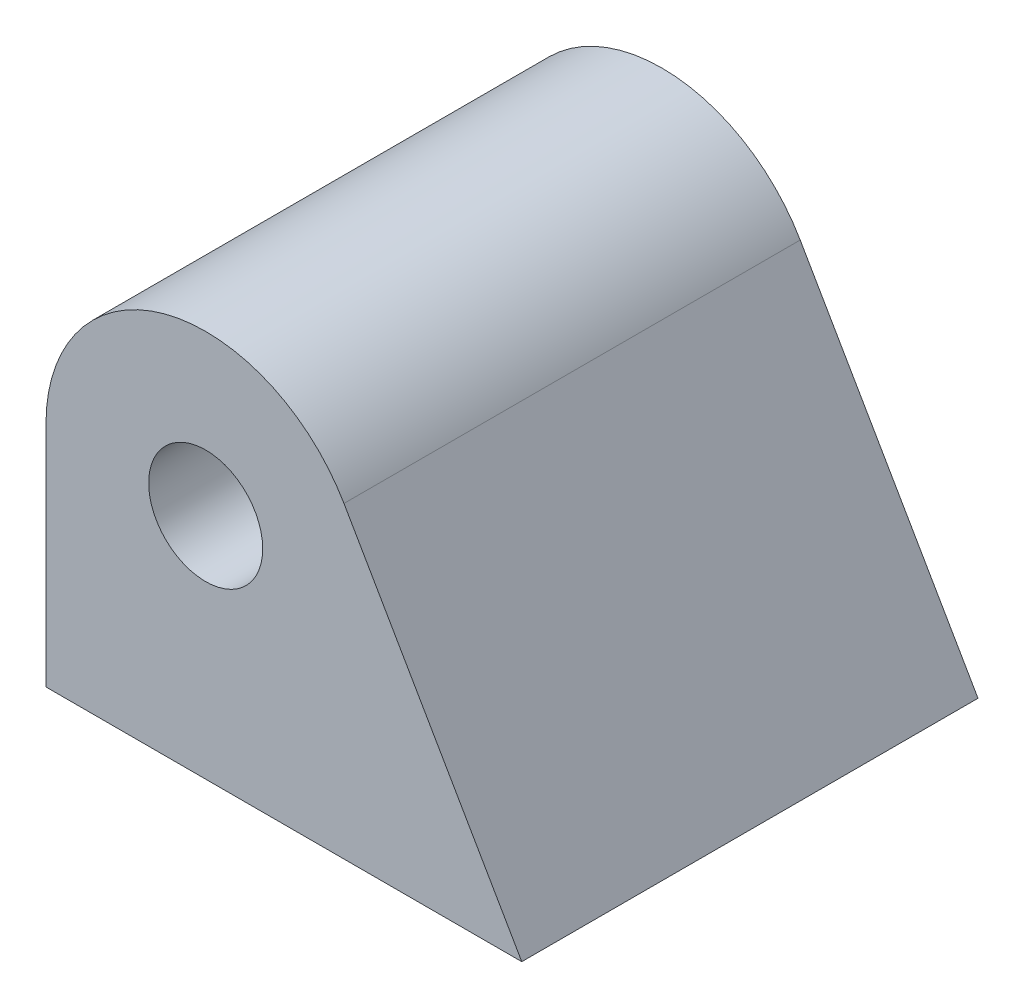
from build123d import *

# Parameters (mm, degrees)
SKETCH1_R           = 3.175
BOSS_EXTRUDE1_DEPTH = 25.4


with BuildPart() as part:
    # Sketch1 → Boss-Extrude1 (new body)
    with BuildSketch(Plane.XY):
        with BuildLine():
            Line((0, 0), (26.487636205, 0))
            Line((26.487636205, 0), (16.58896584, 17.145))
            ThreePointArc((16.58896584, 17.145), (6.589098689, 21.287080596), (0, 12.7))
            Line((0, 12.7), (0, 0))
        make_face()
        with Locations((8.89, 12.7)):
            Circle(SKETCH1_R, mode=Mode.SUBTRACT)
    extrude(amount=BOSS_EXTRUDE1_DEPTH)


solid = part.part
